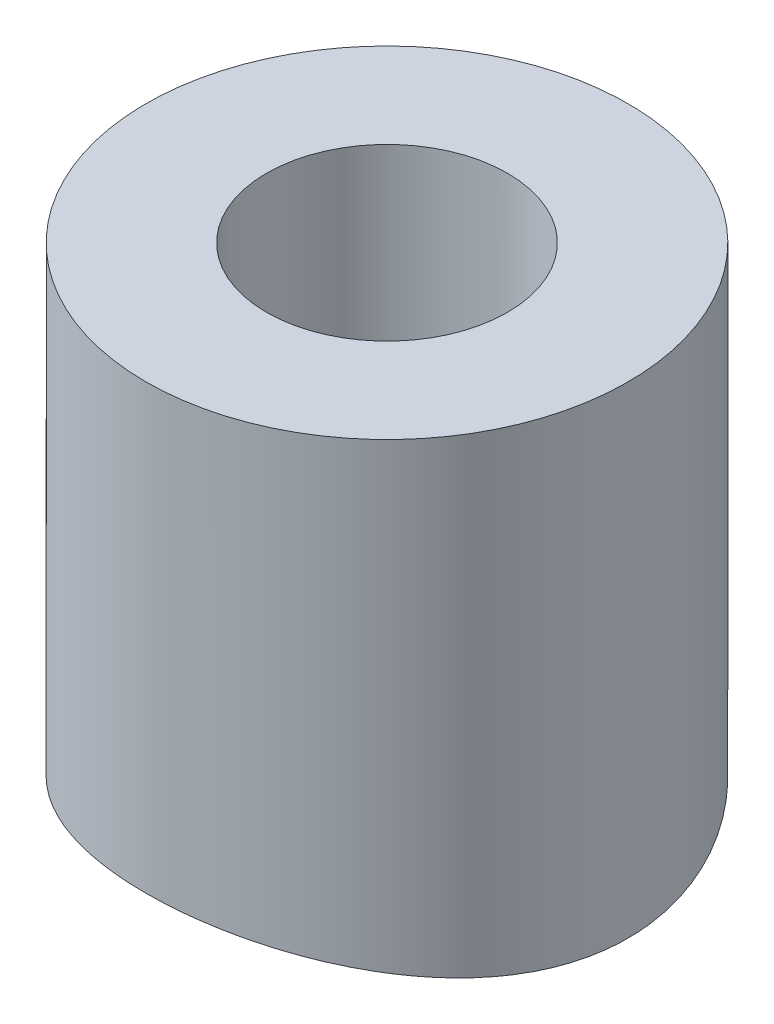
from build123d import *

# Parameters (mm, degrees)
BOSS_EXTRUDE1_DEPTH      = 7.35
BOSS_EXTRUDE1_DEPTH_BACK = 3
SKETCH1_R                = 4
SKETCH1_R_2              = 2
CUT_EXTRUDE1_DEPTH       = 13
CUT_EXTRUDE1_DEPTH_BACK  = 13
SKETCH2_R                = 12.7


with BuildPart() as part:
    # Sketch1 → Boss-Extrude1 (new, two sides: drawn at the far end of the back side and taken through both)
    with BuildSketch(Plane(origin=(0, 0, 0), x_dir=(1, 0, 0), z_dir=(0, 1, 0)).offset(-BOSS_EXTRUDE1_DEPTH_BACK)):
        Circle(SKETCH1_R)
        Circle(SKETCH1_R_2, mode=Mode.SUBTRACT)
    extrude(amount=BOSS_EXTRUDE1_DEPTH + BOSS_EXTRUDE1_DEPTH_BACK)

    # Sketch2 → Cut-Extrude1 (cut, two sides: drawn at the far end of the back side and taken through both)
    with BuildSketch(Plane.XY.offset(-CUT_EXTRUDE1_DEPTH_BACK)):
        with Locations((0, -12.7)):
            Circle(SKETCH2_R)
    extrude(amount=CUT_EXTRUDE1_DEPTH + CUT_EXTRUDE1_DEPTH_BACK, mode=Mode.SUBTRACT)


solid = part.part
